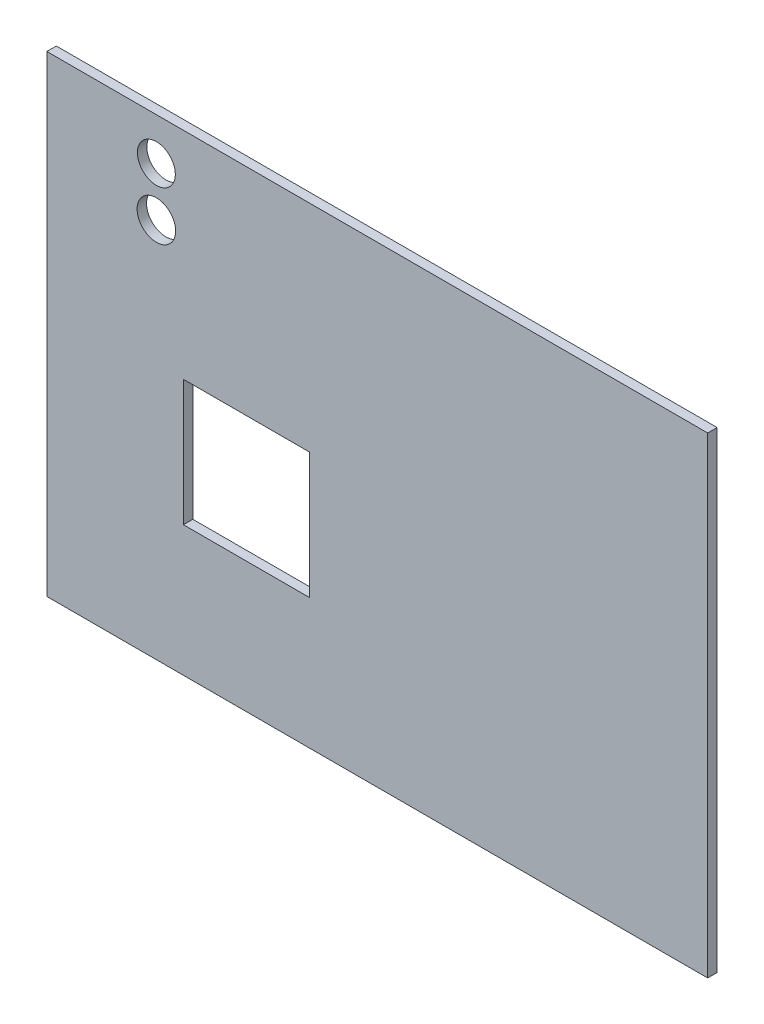
from build123d import *

# Parameters (mm, degrees)
SKETCH3_W           = 210
SKETCH3_H           = 150
BOSS_EXTRUDE3_DEPTH = 3
SKETCH4_W           = 40
SKETCH4_H           = 40.033645827
CUT_EXTRUDE2_DEPTH  = 10
SKETCH6_R           = 6.123115527
SKETCH6_R_2         = 6.021528495
CUT_EXTRUDE4_DEPTH  = 10


with BuildPart() as part:
    # Sketch3 → Boss-Extrude3 (new body)
    with BuildSketch(Plane.XY):
        with Locations((56.698645522, -91.038012074)):
            Rectangle(SKETCH3_W, SKETCH3_H)
    extrude(amount=-BOSS_EXTRUDE3_DEPTH)

    # Sketch4 → Cut-Extrude2 (cut)
    with BuildSketch(Plane.XY):
        with Locations((15.083968717, -104.581913211)):
            Rectangle(SKETCH4_W, SKETCH4_H)
    extrude(amount=-CUT_EXTRUDE2_DEPTH, mode=Mode.SUBTRACT)

    # Sketch6 → Cut-Extrude4 (cut)
    with BuildSketch(Plane.XY):
        with Locations((-13.502002571, -45.038518666)):
            Circle(SKETCH6_R)
        with Locations((-13.502002571, -29.469595459)):
            Circle(SKETCH6_R_2)
    extrude(amount=-CUT_EXTRUDE4_DEPTH, mode=Mode.SUBTRACT)


solid = part.part
